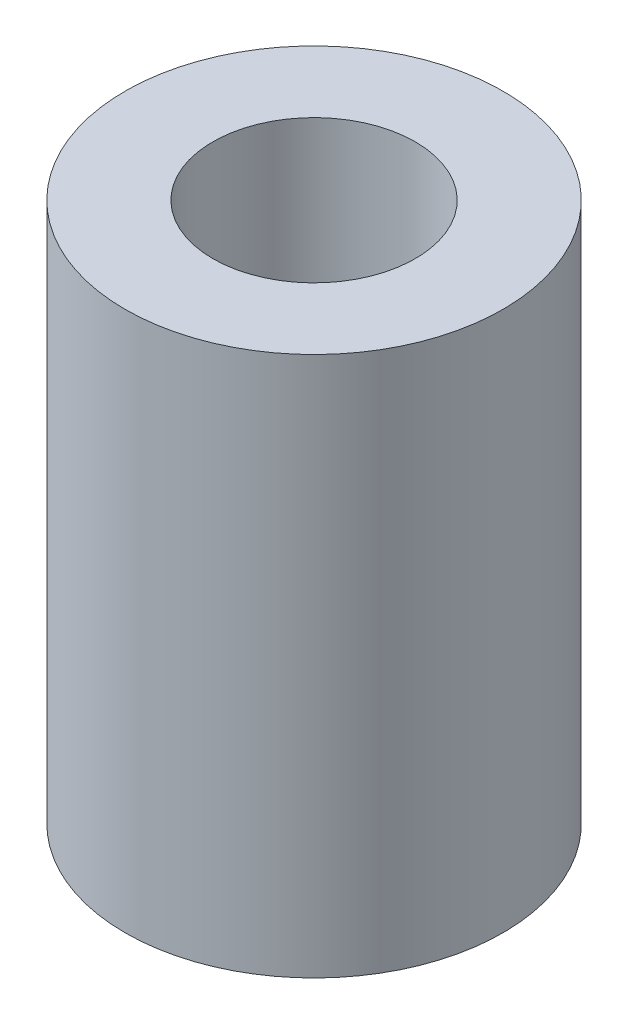
from build123d import *

# Parameters (mm, degrees)
CROQUIS1_R              = 3.5
CROQUIS1_R_2            = 1.875
SALIENTE_EXTRUIR1_DEPTH = 10


with BuildPart() as part:
    # Croquis1 → Saliente-Extruir1 (new body)
    with BuildSketch(Plane(origin=(0, 0, 0), x_dir=(1, 0, 0), z_dir=(0, 1, 0))):
        with Locations(Location((0, 0, 0), (0, 0, 270))):
            Circle(CROQUIS1_R)
        with Locations(Location((0, 0, 0), (0, 0, 270))):
            Circle(CROQUIS1_R_2, mode=Mode.SUBTRACT)
    extrude(amount=SALIENTE_EXTRUIR1_DEPTH)


solid = part.part
